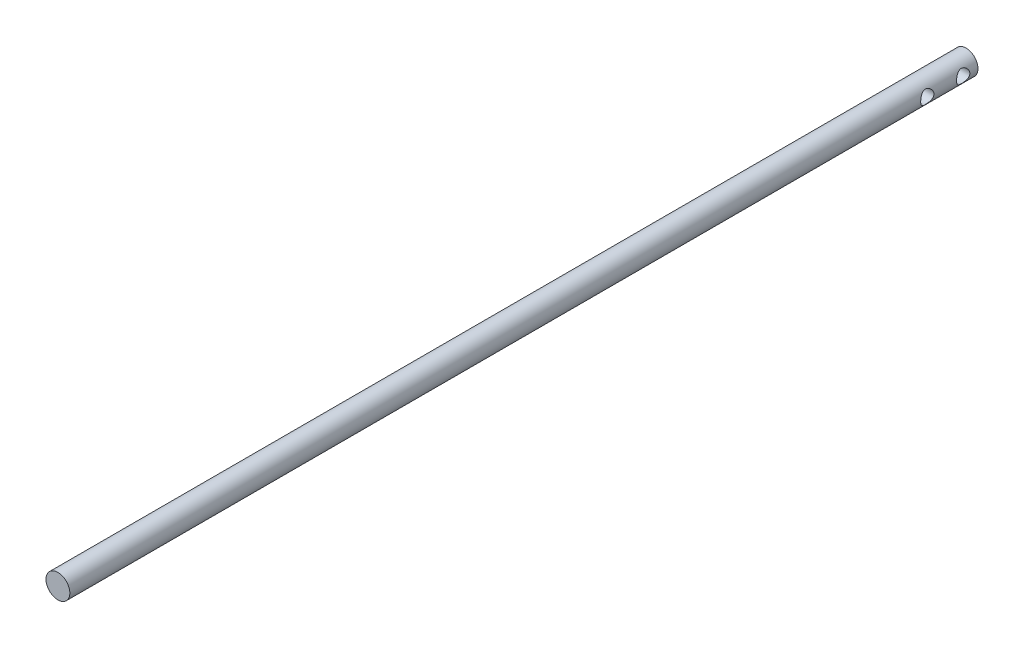
from build123d import *

# Parameters (mm, degrees)
SKETCH1_R           = 3.81
BOSS_EXTRUDE1_DEPTH = 290.195
SKETCH8_R           = 2.11759327
CUT_EXTRUDE4_DEPTH  = 28.702


with BuildPart() as part:
    # Sketch1 → Boss-Extrude1 (new body)
    with BuildSketch(Plane.XY):
        Circle(SKETCH1_R)
    extrude(amount=BOSS_EXTRUDE1_DEPTH)

    # Sketch8 → Cut-Extrude4 (cut)
    with BuildSketch(Plane(origin=(5.08, 0, 0), x_dir=(0, 0, -1), z_dir=(1, 0, 0))):
        with Locations(Location((-4.725558565, 0, 0), (0, 0, 180.000000004))):
            Circle(SKETCH8_R)
        with Locations(Location((-16.188414686, 0, 0), (0, 0, 180.000000004))):
            Circle(SKETCH8_R)
    extrude(amount=-CUT_EXTRUDE4_DEPTH, mode=Mode.SUBTRACT)


solid = part.part
